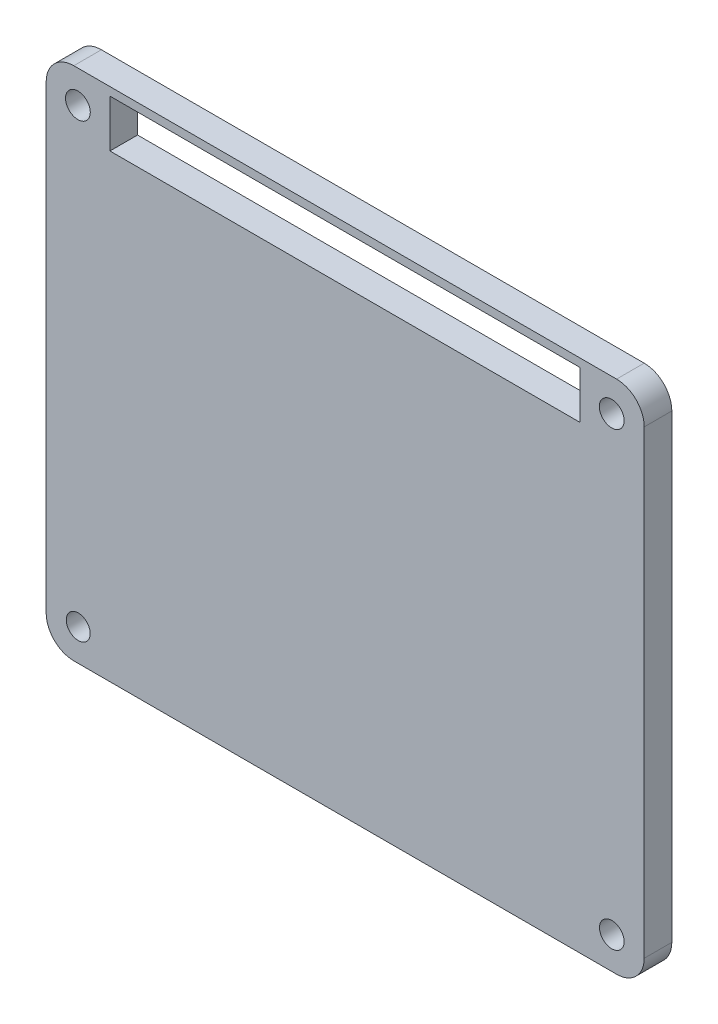
from build123d import *

# Parameters (mm, degrees)
ESQUISSE1_R        = 1.345345221
ESQUISSE1_R_2      = 1.346909221
ESQUISSE1_R_3      = 1.298611316
ESQUISSE1_R_4      = 1.335683761
ESQUISSE1_W        = 51.06055426
ESQUISSE1_H        = 5.162843369
BOSS_EXTRU_1_DEPTH = 3


with BuildPart() as part:
    # Esquisse1 → Boss.-Extru.1 (new body)
    with BuildSketch(Plane.XY):
        with BuildLine():
            Line((142.914343154, 306.333520822), (201.871913252, 306.333520822))
            ThreePointArc((201.871913252, 306.333520822), (203.993233595, 305.454841166), (204.871913252, 303.333520822))
            Line((204.871913252, 303.333520822), (204.871913252, 253.348131253))
            ThreePointArc((204.871913252, 253.348131253), (203.993233595, 251.22681091), (201.871913252, 250.348131253))
            Line((201.871913252, 250.348131253), (142.914343154, 250.348131253))
            ThreePointArc((142.914343154, 250.348131253), (140.793022811, 251.22681091), (139.914343154, 253.348131253))
            Line((139.914343154, 253.348131253), (139.914343154, 303.333520822))
            ThreePointArc((139.914343154, 303.333520822), (140.793022811, 305.454841166), (142.914343154, 306.333520822))
        make_face()
        with Locations((143.360544481, 302.831604494)):
            Circle(ESQUISSE1_R, mode=Mode.SUBTRACT)
        with Locations((201.344684378, 302.818633302)):
            Circle(ESQUISSE1_R_2, mode=Mode.SUBTRACT)
        with Locations((143.395469299, 253.802031827)):
            Circle(ESQUISSE1_R_3, mode=Mode.SUBTRACT)
        with Locations((201.354862046, 253.815125268)):
            Circle(ESQUISSE1_R_4, mode=Mode.SUBTRACT)
        with Locations((172.371550879, 302.856687584)):
            Rectangle(ESQUISSE1_W, ESQUISSE1_H, mode=Mode.SUBTRACT)
    extrude(amount=BOSS_EXTRU_1_DEPTH)


solid = part.part
